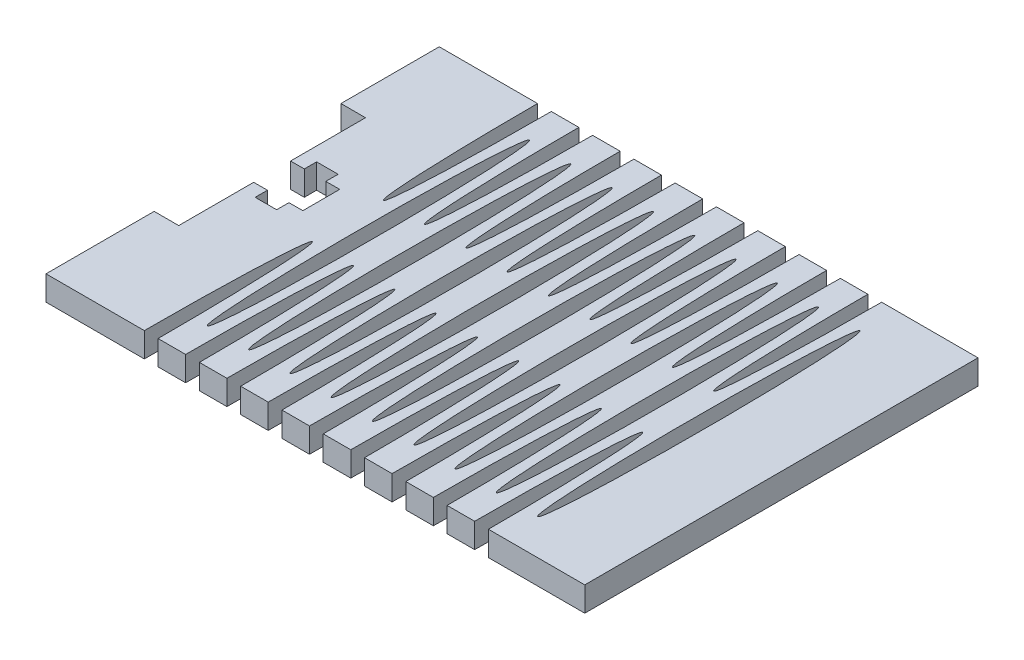
from build123d import *

# Parameters (mm, degrees)
SKETCH1_RX          = 20.79625
SKETCH1_RY          = 0.9525
BOSS_EXTRUDE1_DEPTH = 3.175


with BuildPart() as part:
    # Sketch1 → Boss-Extrude1 (new body)
    with BuildSketch(Plane(origin=(0, 0, 0), x_dir=(1, 0, 0), z_dir=(0, 1, 0))):
        with BuildLine():
            Line((0, 13.97), (3.175, 13.97))
            Line((3.175, 13.97), (3.175, 23.65375))
            Line((3.175, 23.65375), (4.953, 23.65375))
            Line((4.953, 23.65375), (4.953, 22.06625))
            Line((4.953, 22.06625), (7.731125, 22.06625))
            Line((7.731125, 22.06625), (7.731125, 23.65375))
            Line((7.731125, 23.65375), (9.525, 23.65375))
            Line((9.525, 23.65375), (9.525, 28.41625))
            Line((9.525, 28.41625), (7.731125, 28.41625))
            Line((7.731125, 28.41625), (7.731125, 30.00375))
            Line((7.731125, 30.00375), (4.953, 30.00375))
            Line((4.953, 30.00375), (4.953, 28.41625))
            Line((4.953, 28.41625), (3.175, 28.41625))
            Line((3.175, 28.41625), (3.175, 38.1))
            Line((3.175, 38.1), (0, 38.1))
            Line((0, 38.1), (0, 50.8))
            Line((0, 50.8), (12.7, 50.8))
            add(Edge.make_bspline(
                [(12.7, 50.8), (12.7, 30.00375), (13.589, 30.00375), (14.478, 30.00375), (14.478, 50.8)],
                knots=[1.570796327, 1.570796327, 1.570796327, 3.141592654, 3.141592654, 4.71238898, 4.71238898, 4.71238898], degree=2, weights=[1, 0.707106781, 1, 0.707106781, 1]))
            Line((14.478, 50.8), (18.034, 50.8))
            add(Edge.make_bspline(
                [(18.034, 50.8), (18.034, 30.00375), (18.923, 30.00375), (19.812, 30.00375), (19.812, 50.8)],
                knots=[1.570796327, 1.570796327, 1.570796327, 3.141592654, 3.141592654, 4.71238898, 4.71238898, 4.71238898], degree=2, weights=[1, 0.707106781, 1, 0.707106781, 1]))
            Line((19.812, 50.8), (23.368, 50.8))
            add(Edge.make_bspline(
                [(23.368, 50.8), (23.368, 30.00375), (24.257, 30.00375), (25.146, 30.00375), (25.146, 50.8)],
                knots=[4.71238898, 4.71238898, 4.71238898, 6.283185307, 6.283185307, 7.853981634, 7.853981634, 7.853981634], degree=2, weights=[1, 0.707106781, 1, 0.707106781, 1]))
            Line((25.146, 50.8), (28.702, 50.8))
            add(Edge.make_bspline(
                [(28.702, 50.8), (28.702, 30.00375), (29.591, 30.00375), (30.48, 30.00375), (30.48, 50.8)],
                knots=[4.71238898, 4.71238898, 4.71238898, 6.283185307, 6.283185307, 7.853981634, 7.853981634, 7.853981634], degree=2, weights=[1, 0.707106781, 1, 0.707106781, 1]))
            Line((30.48, 50.8), (34.036, 50.8))
            add(Edge.make_bspline(
                [(34.036, 50.8), (34.036, 30.00375), (34.925, 30.00375), (35.814, 30.00375), (35.814, 50.8)],
                knots=[4.71238898, 4.71238898, 4.71238898, 6.283185307, 6.283185307, 7.853981634, 7.853981634, 7.853981634], degree=2, weights=[1, 0.707106781, 1, 0.707106781, 1]))
            Line((35.814, 50.8), (39.37, 50.8))
            add(Edge.make_bspline(
                [(39.37, 50.8), (39.37, 30.00375), (40.259, 30.00375), (41.148, 30.00375), (41.148, 50.8)],
                knots=[4.71238898, 4.71238898, 4.71238898, 6.283185307, 6.283185307, 7.853981634, 7.853981634, 7.853981634], degree=2, weights=[1, 0.707106781, 1, 0.707106781, 1]))
            Line((41.148, 50.8), (44.704, 50.8))
            add(Edge.make_bspline(
                [(44.704, 50.8), (44.704, 30.00375), (45.593, 30.00375), (46.482, 30.00375), (46.482, 50.8)],
                knots=[4.71238898, 4.71238898, 4.71238898, 6.283185307, 6.283185307, 7.853981634, 7.853981634, 7.853981634], degree=2, weights=[1, 0.707106781, 1, 0.707106781, 1]))
            Line((46.482, 50.8), (50.038, 50.8))
            add(Edge.make_bspline(
                [(50.038, 50.8), (50.038, 30.00375), (50.927, 30.00375), (51.816, 30.00375), (51.816, 50.8)],
                knots=[1.570796327, 1.570796327, 1.570796327, 3.141592654, 3.141592654, 4.71238898, 4.71238898, 4.71238898], degree=2, weights=[1, 0.707106781, 1, 0.707106781, 1]))
            Line((51.816, 50.8), (55.372, 50.8))
            add(Edge.make_bspline(
                [(55.372, 50.8), (55.372, 30.00375), (56.261, 30.00375), (57.15, 30.00375), (57.15, 50.8)],
                knots=[1.570796327, 1.570796327, 1.570796327, 3.141592654, 3.141592654, 4.71238898, 4.71238898, 4.71238898], degree=2, weights=[1, 0.707106781, 1, 0.707106781, 1]))
            Line((57.15, 50.8), (60.706, 50.8))
            Line((60.706, 50.8), (69.596, 50.8))
            Line((69.596, 50.8), (69.596, 0))
            Line((69.596, 0), (60.706, 0))
            Line((60.706, 0), (57.15, 0))
            add(Edge.make_bspline(
                [(57.15, 0), (57.15, 20.79625), (56.261, 20.79625), (55.372, 20.79625), (55.372, 0)],
                knots=[4.71238898, 4.71238898, 4.71238898, 6.283185307, 6.283185307, 7.853981634, 7.853981634, 7.853981634], degree=2, weights=[1, 0.707106781, 1, 0.707106781, 1]))
            Line((55.372, 0), (51.816, 0))
            add(Edge.make_bspline(
                [(51.816, 0), (51.816, 20.79625), (50.927, 20.79625), (50.038, 20.79625), (50.038, 0)],
                knots=[4.71238898, 4.71238898, 4.71238898, 6.283185307, 6.283185307, 7.853981634, 7.853981634, 7.853981634], degree=2, weights=[1, 0.707106781, 1, 0.707106781, 1]))
            Line((50.038, 0), (46.482, 0))
            add(Edge.make_bspline(
                [(46.482, 0), (46.482, 20.79625), (45.593, 20.79625), (44.704, 20.79625), (44.704, 0)],
                knots=[4.71238898, 4.71238898, 4.71238898, 6.283185307, 6.283185307, 7.853981634, 7.853981634, 7.853981634], degree=2, weights=[1, 0.707106781, 1, 0.707106781, 1]))
            Line((44.704, 0), (41.148, 0))
            add(Edge.make_bspline(
                [(41.148, 0), (41.148, 20.79625), (40.259, 20.79625), (39.37, 20.79625), (39.37, 0)],
                knots=[4.71238898, 4.71238898, 4.71238898, 6.283185307, 6.283185307, 7.853981634, 7.853981634, 7.853981634], degree=2, weights=[1, 0.707106781, 1, 0.707106781, 1]))
            Line((39.37, 0), (35.814, 0))
            add(Edge.make_bspline(
                [(35.814, 0), (35.814, 20.79625), (34.925, 20.79625), (34.036, 20.79625), (34.036, 0)],
                knots=[4.71238898, 4.71238898, 4.71238898, 6.283185307, 6.283185307, 7.853981634, 7.853981634, 7.853981634], degree=2, weights=[1, 0.707106781, 1, 0.707106781, 1]))
            Line((34.036, 0), (30.48, 0))
            add(Edge.make_bspline(
                [(30.48, 0), (30.48, 20.79625), (29.591, 20.79625), (28.702, 20.79625), (28.702, 0)],
                knots=[4.71238898, 4.71238898, 4.71238898, 6.283185307, 6.283185307, 7.853981634, 7.853981634, 7.853981634], degree=2, weights=[1, 0.707106781, 1, 0.707106781, 1]))
            Line((28.702, 0), (25.146, 0))
            add(Edge.make_bspline(
                [(25.146, 0), (25.146, 20.79625), (24.257, 20.79625), (23.368, 20.79625), (23.368, 0)],
                knots=[4.71238898, 4.71238898, 4.71238898, 6.283185307, 6.283185307, 7.853981634, 7.853981634, 7.853981634], degree=2, weights=[1, 0.707106781, 1, 0.707106781, 1]))
            Line((23.368, 0), (19.812, 0))
            add(Edge.make_bspline(
                [(19.812, 0), (19.812, 20.79625), (18.923, 20.79625), (18.034, 20.79625), (18.034, 0)],
                knots=[4.71238898, 4.71238898, 4.71238898, 6.283185307, 6.283185307, 7.853981634, 7.853981634, 7.853981634], degree=2, weights=[1, 0.707106781, 1, 0.707106781, 1]))
            Line((18.034, 0), (14.478, 0))
            add(Edge.make_bspline(
                [(14.478, 0), (14.478, 20.79625), (13.589, 20.79625), (12.7, 20.79625), (12.7, 0)],
                knots=[4.71238898, 4.71238898, 4.71238898, 6.283185307, 6.283185307, 7.853981634, 7.853981634, 7.853981634], degree=2, weights=[1, 0.707106781, 1, 0.707106781, 1]))
            Line((12.7, 0), (0, 0))
            Line((0, 0), (0, 13.97))
        make_face()
        with Locations(Location((16.256, 25.4), (0, 0, -90))):
            Ellipse(SKETCH1_RX, SKETCH1_RY, mode=Mode.SUBTRACT)
        with Locations(Location((21.59, 25.4), (0, 0, -90))):
            Ellipse(SKETCH1_RX, SKETCH1_RY, mode=Mode.SUBTRACT)
        with Locations(Location((26.924, 25.4), (0, 0, -90))):
            Ellipse(SKETCH1_RX, SKETCH1_RY, mode=Mode.SUBTRACT)
        with Locations(Location((32.258, 25.4), (0, 0, -90))):
            Ellipse(SKETCH1_RX, SKETCH1_RY, mode=Mode.SUBTRACT)
        with Locations(Location((37.592, 25.4), (0, 0, -90))):
            Ellipse(SKETCH1_RX, SKETCH1_RY, mode=Mode.SUBTRACT)
        with Locations(Location((42.926, 25.4), (0, 0, -90))):
            Ellipse(SKETCH1_RX, SKETCH1_RY, mode=Mode.SUBTRACT)
        with Locations(Location((48.26, 25.4), (0, 0, -90))):
            Ellipse(SKETCH1_RX, SKETCH1_RY, mode=Mode.SUBTRACT)
        with Locations(Location((53.594, 25.4), (0, 0, -90))):
            Ellipse(SKETCH1_RX, SKETCH1_RY, mode=Mode.SUBTRACT)
        with Locations(Location((58.928, 25.4), (0, 0, -90))):
            Ellipse(SKETCH1_RX, SKETCH1_RY, mode=Mode.SUBTRACT)
    extrude(amount=BOSS_EXTRUDE1_DEPTH)


solid = part.part
